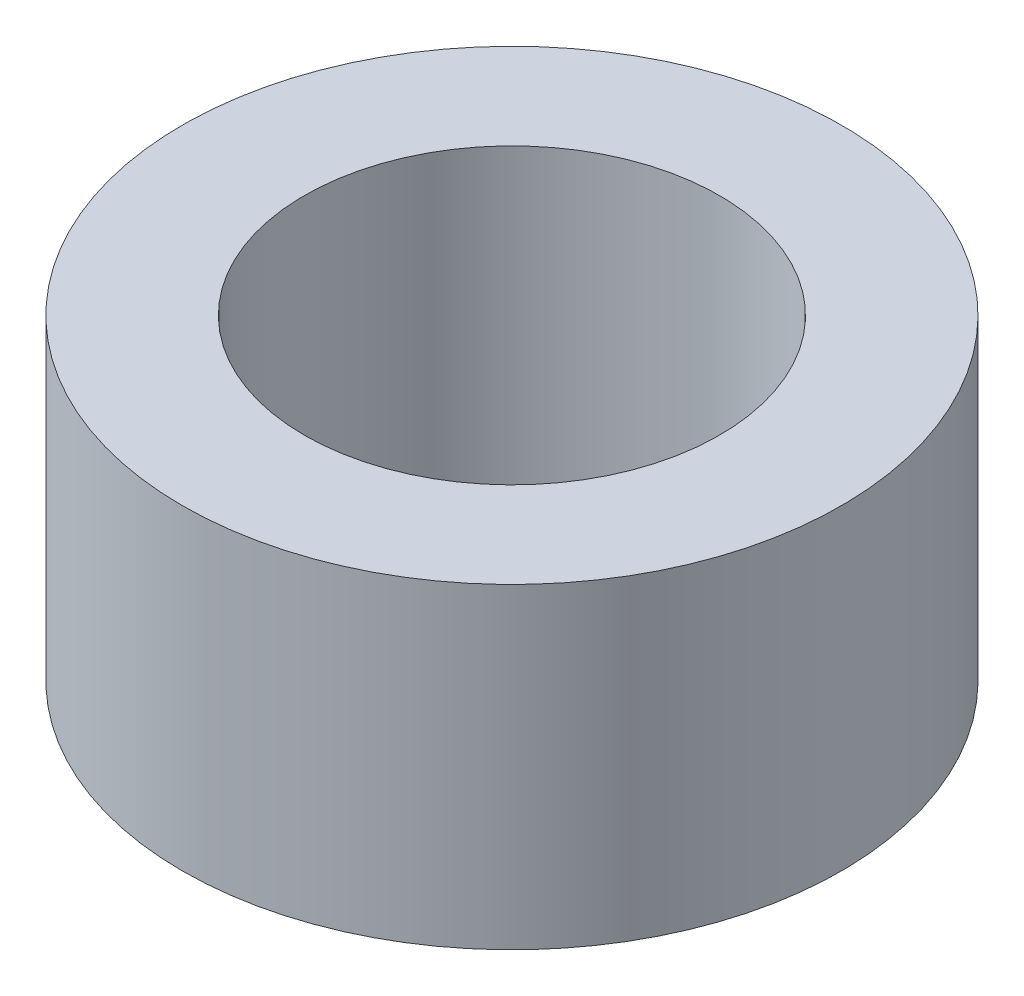
from build123d import *

# Parameters (mm, degrees)
SKETCH1_R           = 3.175
SKETCH1_R_2         = 1.999996
BOSS_EXTRUDE1_DEPTH = 3.048


with BuildPart() as part:
    # Sketch1 → Boss-Extrude1 (new body)
    with BuildSketch(Plane(origin=(0, 0, 0), x_dir=(1, 0, 0), z_dir=(0, 1, 0))):
        with Locations(Location((0, 0, 0), (0, 0, 270))):
            Circle(SKETCH1_R)
        with Locations(Location((0, 0, 0), (0, 0, 270))):
            Circle(SKETCH1_R_2, mode=Mode.SUBTRACT)
    extrude(amount=-BOSS_EXTRUDE1_DEPTH)


solid = part.part
